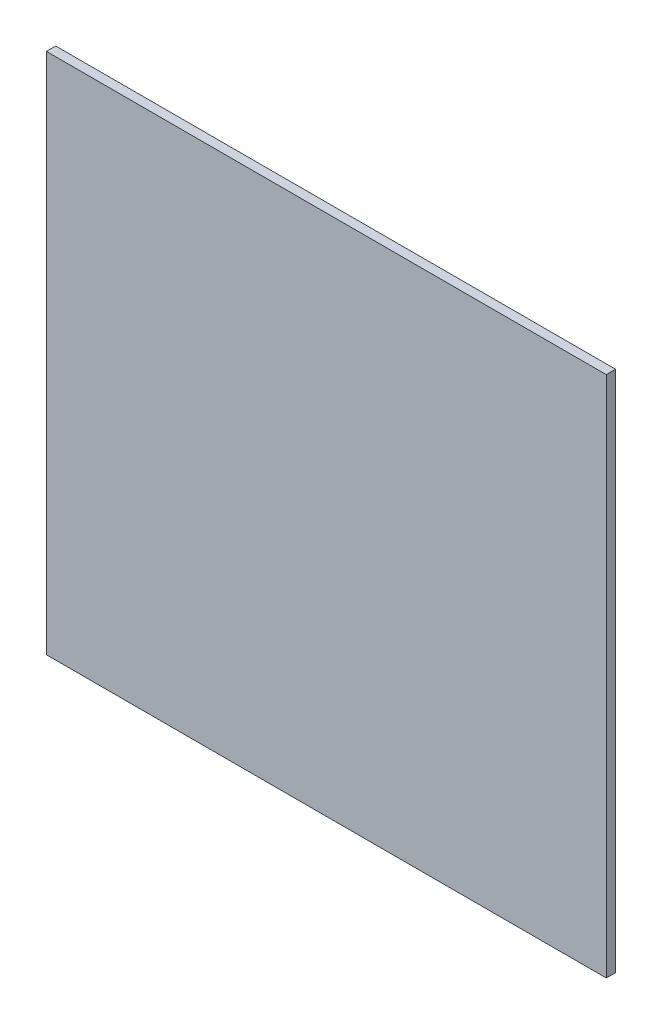
from build123d import *

# Parameters (mm, degrees)
SKIZZE1_W                       = 300
SKIZZE1_H                       = 280
AUFSATZ_LINEAR_AUSTRAGEN1_DEPTH = 5


with BuildPart() as part:
    # Skizze1 → Aufsatz-Linear austragen1 (new body)
    with BuildSketch(Plane.XY):
        Rectangle(SKIZZE1_W, SKIZZE1_H)
    extrude(amount=AUFSATZ_LINEAR_AUSTRAGEN1_DEPTH)


solid = part.part
